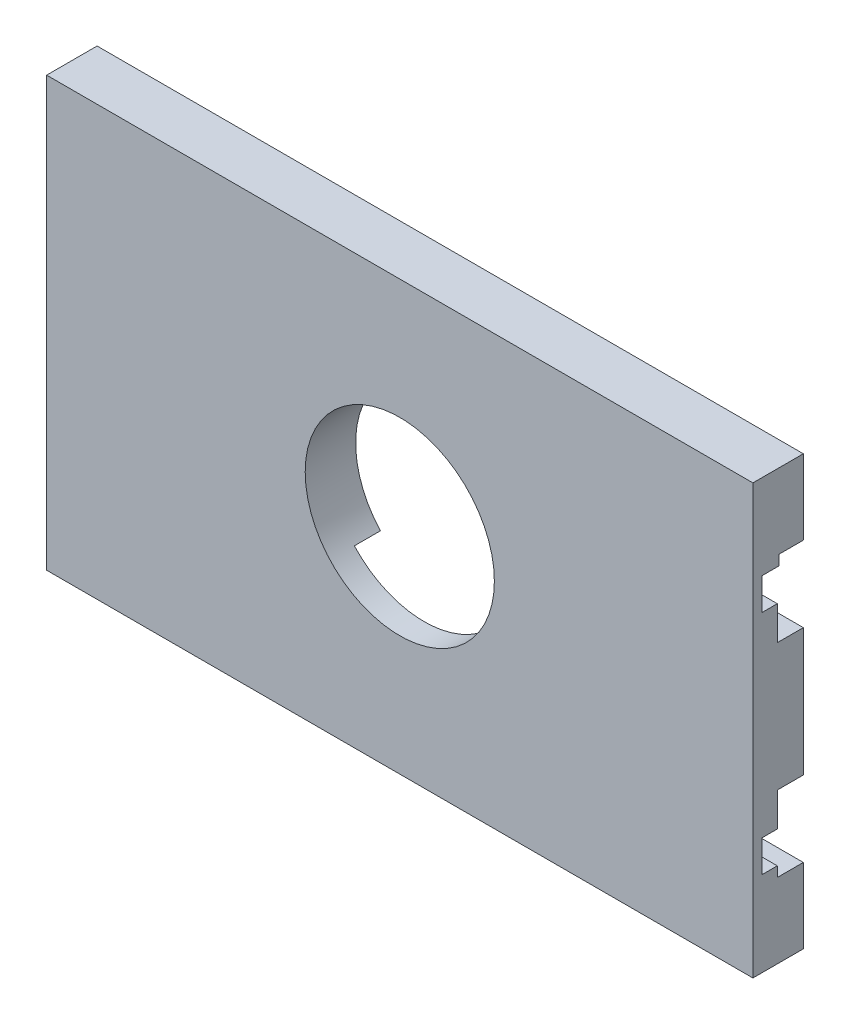
from build123d import *

# Parameters (mm, degrees)
BOSS_EXTRUDE1_DEPTH = 140
SKETCH2_R           = 18.75
CUT_EXTRUDE1_DEPTH  = 147.650093761


with BuildPart() as part:
    # Sketch1 → Boss-Extrude1 (new body)
    with BuildSketch(Plane(origin=(0, 0, 0), x_dir=(0, 0, -1), z_dir=(1, 0, 0))):
        Polygon((0.16, 27.66), (5, 27.66), (5, 42.5), (-5, 42.5), (-5, -42.5), (5, -42.5), (5, -27.66), (-0.16, -27.66), (-0.16, -25.66), (-3.16, -25.66), (-3.16, -19.34), (-0.16, -19.34), (-0.16, -12.650615569), (5, -12.650615569), (5, 12.650615569), (-0.16, 12.650615569), (-0.16, 19.34), (-3.16, 19.34), (-3.16, 25.66), (0.16, 25.66), align=None)
    extrude(amount=BOSS_EXTRUDE1_DEPTH)

    # Sketch2 → Cut-Extrude1 (cut, through all)
    with BuildSketch(Plane.XY.offset(5)):
        with Locations((70, 0)):
            Circle(SKETCH2_R)
    extrude(amount=-CUT_EXTRUDE1_DEPTH, mode=Mode.SUBTRACT)


solid = part.part
